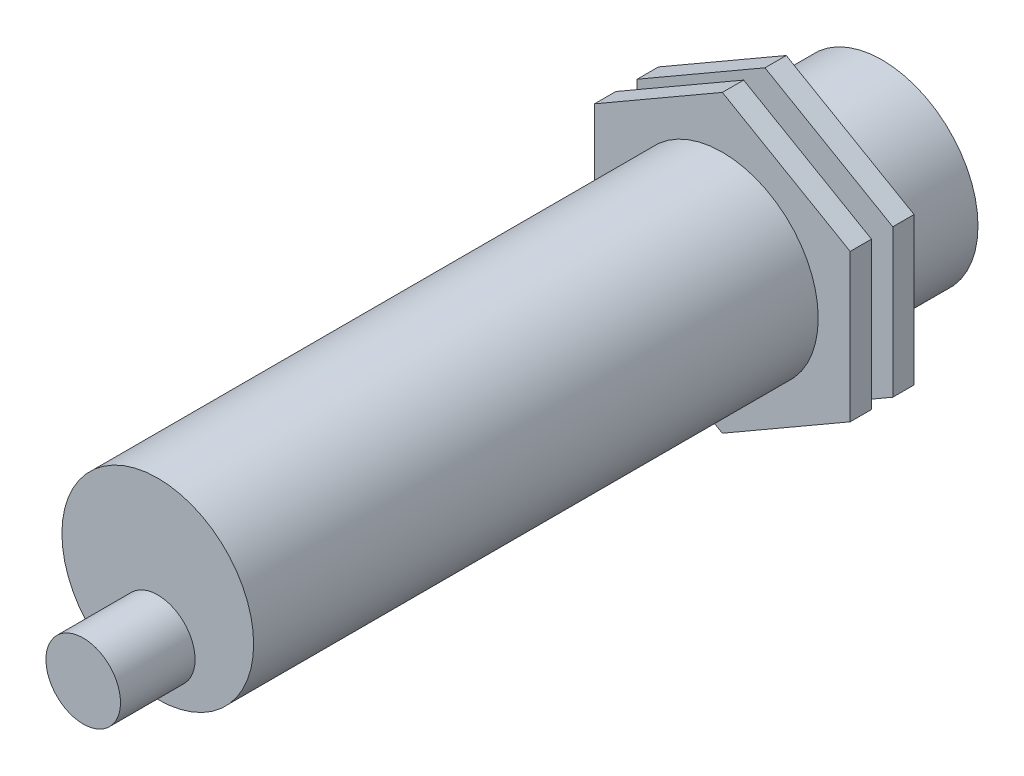
from build123d import *

# Parameters (mm, degrees)
SKETCH1_R           = 9
BOSS_EXTRUDE1_DEPTH = 68
SKETCH2_R           = 3.5
BOSS_EXTRUDE2_DEPTH = 7
BOSS_EXTRUDE3_DEPTH = 2
BOSS_EXTRUDE4_START = -6
BOSS_EXTRUDE4_DEPTH = 2


with BuildPart() as part:
    # Sketch1 → Boss-Extrude1 (new body)
    with BuildSketch(Plane.XY):
        Circle(SKETCH1_R)
    extrude(amount=BOSS_EXTRUDE1_DEPTH)

    # Sketch2 → Boss-Extrude2 (add)
    with BuildSketch(Plane.XY.offset(68)):
        with Locations((0, -4)):
            Circle(SKETCH2_R)
    extrude(amount=BOSS_EXTRUDE2_DEPTH)

    # Sketch4 → Boss-Extrude3 (add)
    with BuildSketch(Plane(origin=(0, 0, 9), x_dir=(-1, 0, 0), z_dir=(0, 0, -1))):
        Polygon((-12, 6.92820323), (-12, -6.92820323), (0, -13.856406461), (12, -6.92820323), (12, 6.92820323), (0, 13.856406461), align=None)
    extrude(amount=-BOSS_EXTRUDE3_DEPTH)

    # Sketch4<2> → Boss-Extrude4 (add)
    with BuildSketch(Plane(origin=(0, 0, 9), x_dir=(-1, 0, 0), z_dir=(0, 0, -1)).offset(BOSS_EXTRUDE4_START)):
        Polygon((-12, 6.92820323), (-12, -6.92820323), (0, -13.856406461), (12, -6.92820323), (12, 6.92820323), (0, 13.856406461), align=None)
    extrude(amount=BOSS_EXTRUDE4_DEPTH)


solid = part.part
